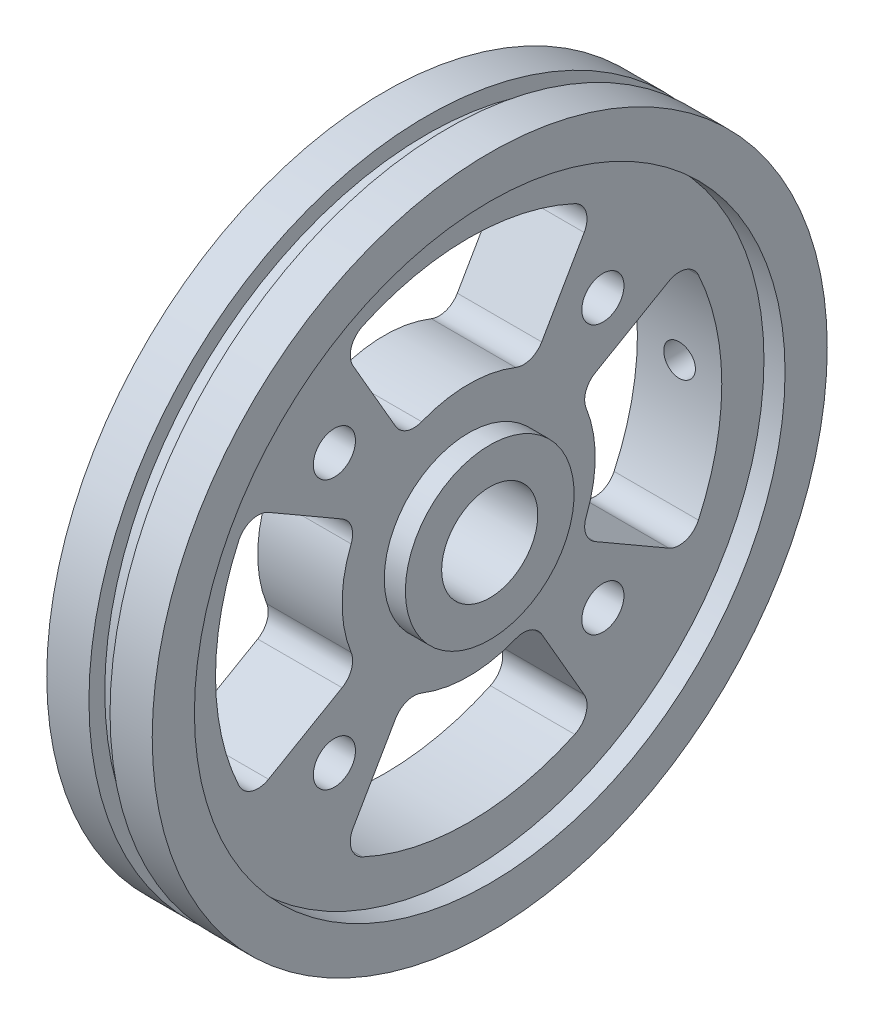
from build123d import *

# Parameters (mm, degrees)
CUT_EXTRUDE1_DEPTH       = 23.978250743
FILLET1_R                = 1
CIRPATTERN1_COUNT        = 4
FILLET1_OF_CIRPATTERN1_R = 1
SKETCH4_W                = 1
SKETCH4_H                = 0.75
SKETCH9_R                = 1
CUT_EXTRUDE4_DEPTH       = 24.173260612
CIRPATTERN3_COUNT        = 4


with BuildPart() as part:
    # Sketch1 → Revolve1 (revolve)
    with BuildSketch(Plane(origin=(0, 0, 0), x_dir=(1, 0, 0), z_dir=(0, 1, 0)), mode=Mode.PRIVATE) as revolve1_sk:
        Polygon((0, 2.28), (0, 16), (5, 16), (5, 14), (4, 14), (4, 4), (5, 4), (5, 2.28), align=None)
    revolve(revolve1_sk.sketch.rotate(Axis((0, 0, 0), (1, 0, 0)), 180), axis=Axis((0, 0, 0), (1, 0, 0)))

    # Sketch2 → Cut-Revolve1 (revolve, cut)
    with BuildSketch(Plane(origin=(0, 0, 0), x_dir=(1, 0, 0), z_dir=(0, 1, 0))):
        Polygon((2, 0), (2, 16), (2.75, 16), (2.75, 11.5), (2.4, 11.5), (2.4, 0), align=None)
    revolve(axis=Axis((2, 0, 0), (0, 0, -1)), mode=Mode.SUBTRACT)

    # Sketch3 → Cut-Extrude1 (cut, through all)
    with BuildSketch(Plane(origin=(4, 0, 0), x_dir=(0, 0, -1), z_dir=(1, 0, 0))):
        with BuildLine():
            Line((5.196152423, 3), (10.392304845, 6))
            ThreePointArc((10.392304845, 6), (12, 0), (10.392304845, -6))
            Line((10.392304845, -6), (5.196152423, -3))
            ThreePointArc((5.196152423, -3), (6, 0), (5.196152423, 3))
        make_face()
    cut_extrude1 = extrude(amount=-CUT_EXTRUDE1_DEPTH, mode=Mode.SUBTRACT)

    # Fillet1
    fillet1_edges = [part.edges().sort_by_distance(p)[0] for p in [
        (2, -3, -5.196152423),
        (2, 6, -10.392304845),
        (2, -6, -10.392304845),
        (2, 3, -5.196152423),
    ]]
    fillet(fillet1_edges, radius=FILLET1_R)

    # CirPattern1: Cut-Extrude1 ×4 about axis
    cirpattern1_axis = Axis((0, 0, 0), (1, 0, 0))
    for i in range(1, CIRPATTERN1_COUNT):
        add(cut_extrude1.rotate(cirpattern1_axis, i * 360 / CIRPATTERN1_COUNT), mode=Mode.SUBTRACT)

    # Fillet1 of CirPattern1
    fillet1_of_cirpattern1_edges = [part.edges().sort_by_distance(p)[0] for p in [
        (2, 5.196152423, -3),
        (2, 10.392304845, 6),
        (2, 10.392304845, -6),
        (2, 5.196152423, 3),
        (2, 3, 5.196152423),
        (2, -6, 10.392304845),
        (2, 6, 10.392304845),
        (2, -3, 5.196152423),
        (2, -5.196152423, 3),
        (2, -10.392304845, -6),
        (2, -10.392304845, 6),
        (2, -5.196152423, -3),
    ]]
    fillet(fillet1_of_cirpattern1_edges, radius=FILLET1_OF_CIRPATTERN1_R)

    # Sketch4 → Cut-Revolve2 (revolve, cut)
    with BuildSketch(Plane(origin=(0, 0, 0), x_dir=(1, 0, 0), z_dir=(0, 1, 0)), mode=Mode.PRIVATE) as cut_revolve2_sk:
        with Locations((2.5, 15.625)):
            Rectangle(SKETCH4_W, SKETCH4_H)
    revolve(cut_revolve2_sk.sketch.rotate(Axis((0, 0, 0), (1, 0, 0)), 180), axis=Axis((0, 0, 0), (1, 0, 0)), mode=Mode.SUBTRACT)

    # Sketch9 → Cut-Extrude4 (cut, through all)
    with BuildSketch(Plane.ZY):
        with Locations((6.363961031, 6.363961031)):
            Circle(SKETCH9_R)
    cut_extrude4 = extrude(amount=-CUT_EXTRUDE4_DEPTH, mode=Mode.SUBTRACT)

    # CirPattern3: Cut-Extrude4 ×4 about axis
    cirpattern3_axis = Axis((0, 0, 0), (1, 0, 0))
    for i in range(1, CIRPATTERN3_COUNT):
        add(cut_extrude4.rotate(cirpattern3_axis, i * 360 / CIRPATTERN3_COUNT), mode=Mode.SUBTRACT)


solid = part.part
